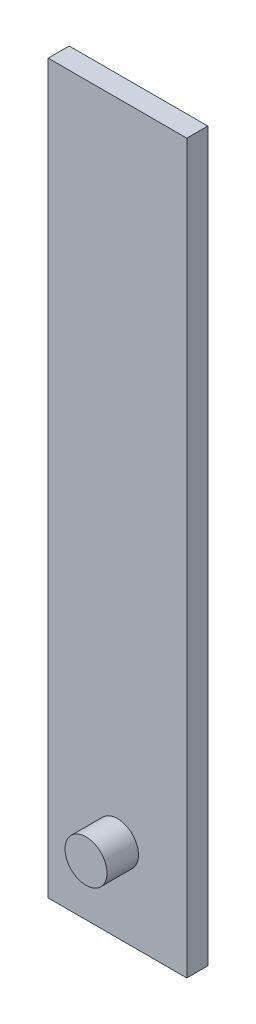
from build123d import *

# Parameters (mm, degrees)
SKETCH_1_W           = 13.199674752
SKETCH_1_H           = 69.2763861
EXTRUDE_1_DEPTH      = 2
EXTRUDE_2_DEPTH      = 3
EXTRUDE_2_DEPTH_BACK = 5
SKETCH_2_R           = 2.000590496


with BuildPart() as part:
    # 草图1 → 凸台-拉伸1 (new body)
    with BuildSketch(Plane.XY):
        Rectangle(SKETCH_1_W, SKETCH_1_H)
    extrude(amount=EXTRUDE_1_DEPTH)

    # 草图2 → 凸台-拉伸2 (add, two sides: drawn at the far end of the back side and taken through both)
    with BuildSketch(Plane.XY.offset(2).offset(-EXTRUDE_2_DEPTH_BACK)):
        with Locations((0, -26.790353818)):
            Circle(SKETCH_2_R)
    extrude(amount=EXTRUDE_2_DEPTH + EXTRUDE_2_DEPTH_BACK)


solid = part.part
